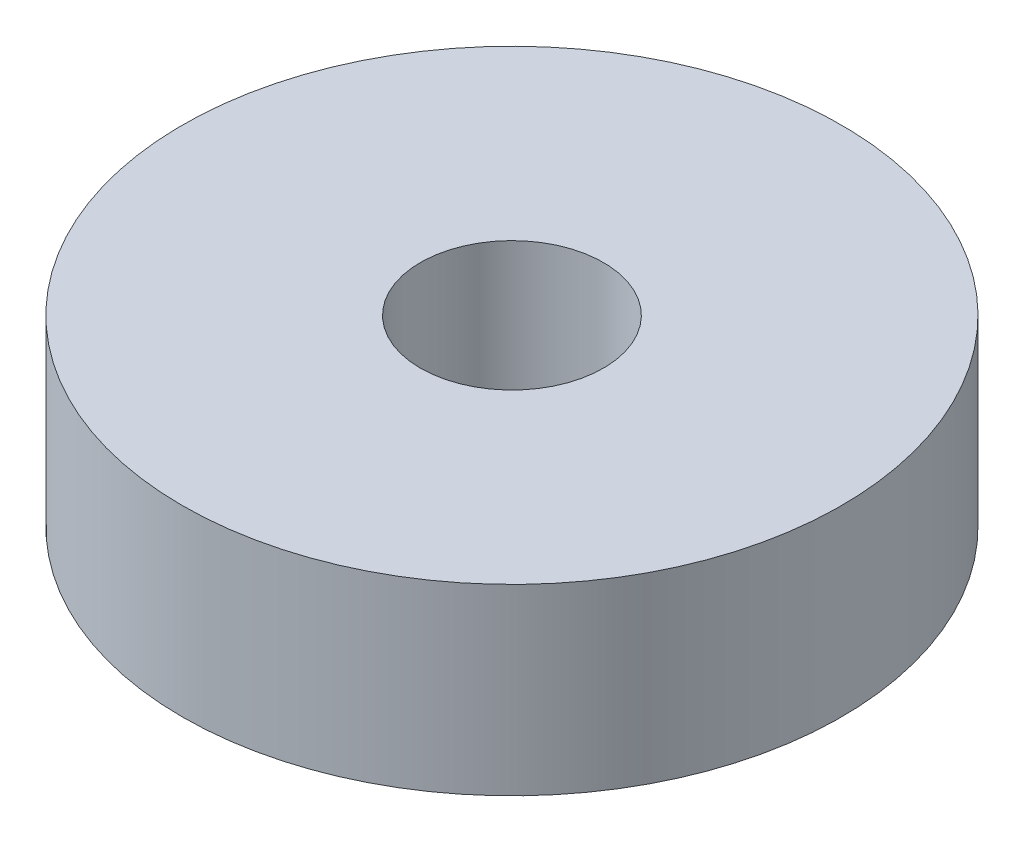
from build123d import *

# Parameters (mm, degrees)
SKETCH1_R           = 9
SKETCH1_R_2         = 2.5
BOSS_EXTRUDE1_DEPTH = 5


with BuildPart() as part:
    # Sketch1 → Boss-Extrude1 (new body)
    with BuildSketch(Plane(origin=(0, 0, 0), x_dir=(1, 0, 0), z_dir=(0, 1, 0))):
        with Locations(Location((0, 0, 0), (0, 0, 270))):
            Circle(SKETCH1_R)
        with Locations(Location((0, 0, 0), (0, 0, 270))):
            Circle(SKETCH1_R_2, mode=Mode.SUBTRACT)
    extrude(amount=BOSS_EXTRUDE1_DEPTH)


solid = part.part
